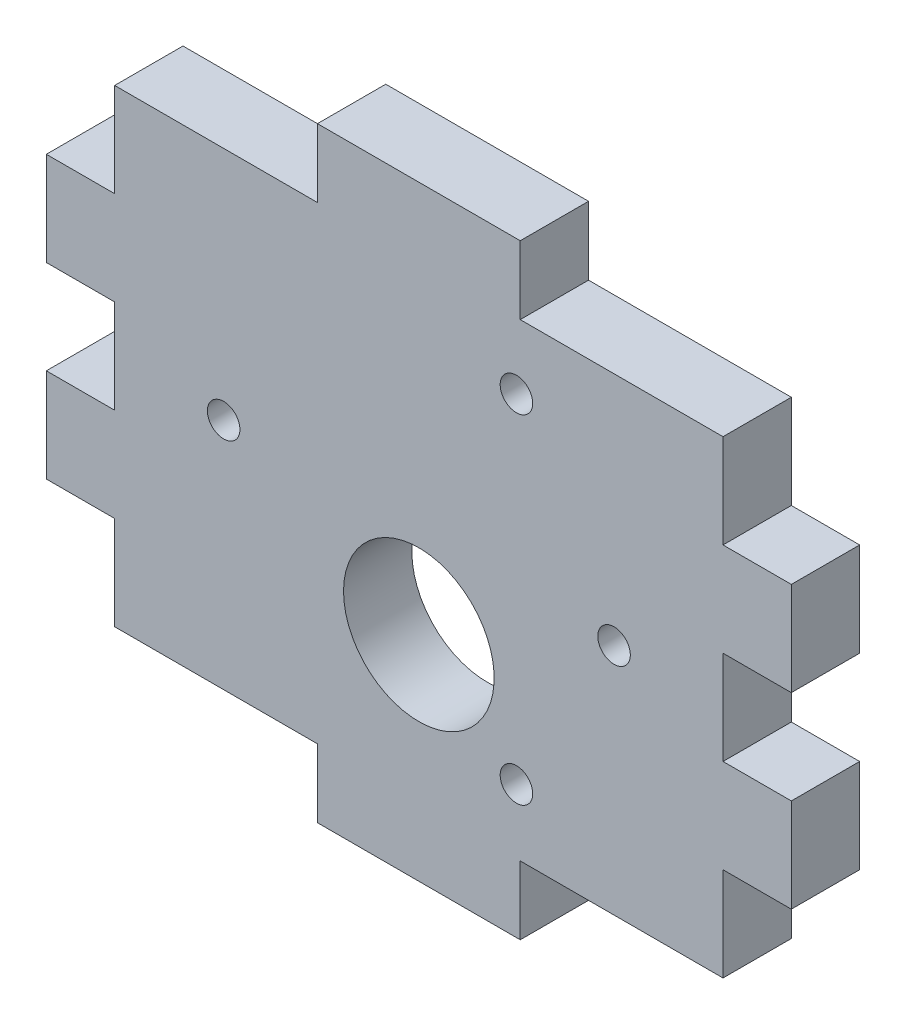
from build123d import *

# Parameters (mm, degrees)
SKETCH1_W           = 47.498
SKETCH1_H           = 36.6014
BOSS_EXTRUDE1_DEPTH = 2.667
SKETCH3_W           = 5.334
SKETCH3_H           = 7.32028
BOSS_EXTRUDE3_DEPTH = 5.334
SKETCH5_W           = 15.832666666
SKETCH5_H           = 5.334
BOSS_EXTRUDE4_DEPTH = 5.334
SKETCH6_R           = 1.27
SKETCH6_R_2         = 5.8801
CUT_EXTRUDE1_DEPTH  = 38.853289013


with BuildPart() as part:
    # Sketch1 → Boss-Extrude1 (new, symmetric)
    with BuildSketch(Plane.XY):
        Rectangle(SKETCH1_W, SKETCH1_H)
    extrude(amount=BOSS_EXTRUDE1_DEPTH, both=True)

    # Sketch3 → Boss-Extrude3 (add)
    with BuildSketch(Plane.XY.offset(2.667)):
        with Locations((-26.416, 7.32028)):
            Rectangle(SKETCH3_W, SKETCH3_H)
        with Locations((-26.416, -7.32028)):
            Rectangle(SKETCH3_W, SKETCH3_H)
        with Locations((26.416, -7.32028)):
            Rectangle(SKETCH3_W, SKETCH3_H)
        with Locations((26.416, 7.32028)):
            Rectangle(SKETCH3_W, SKETCH3_H)
    extrude(amount=-BOSS_EXTRUDE3_DEPTH)

    # Sketch5 → Boss-Extrude4 (add)
    with BuildSketch(Plane.XY.offset(2.667)):
        with Locations((0, -20.9677)):
            Rectangle(SKETCH5_W, SKETCH5_H)
        with Locations((0, 20.9677)):
            Rectangle(SKETCH5_W, SKETCH5_H)
    extrude(amount=-BOSS_EXTRUDE4_DEPTH)

    # Sketch6 → Cut-Extrude1 (cut, through all)
    with BuildSketch(Plane(origin=(0, 0, -2.667), x_dir=(-1, 0, 0), z_dir=(0, 0, -1))):
        with Locations((-15.24, -0.0762)):
            Circle(SKETCH6_R)
        with Locations((-7.62, -13.274427096)):
            Circle(SKETCH6_R)
        with Locations((15.24, -0.0762)):
            Circle(SKETCH6_R)
        with Locations((-7.61999995, 13.122027183)):
            Circle(SKETCH6_R)
        with Locations((0, -6.9596)):
            Circle(SKETCH6_R_2)
    extrude(amount=-CUT_EXTRUDE1_DEPTH, mode=Mode.SUBTRACT)


solid = part.part
